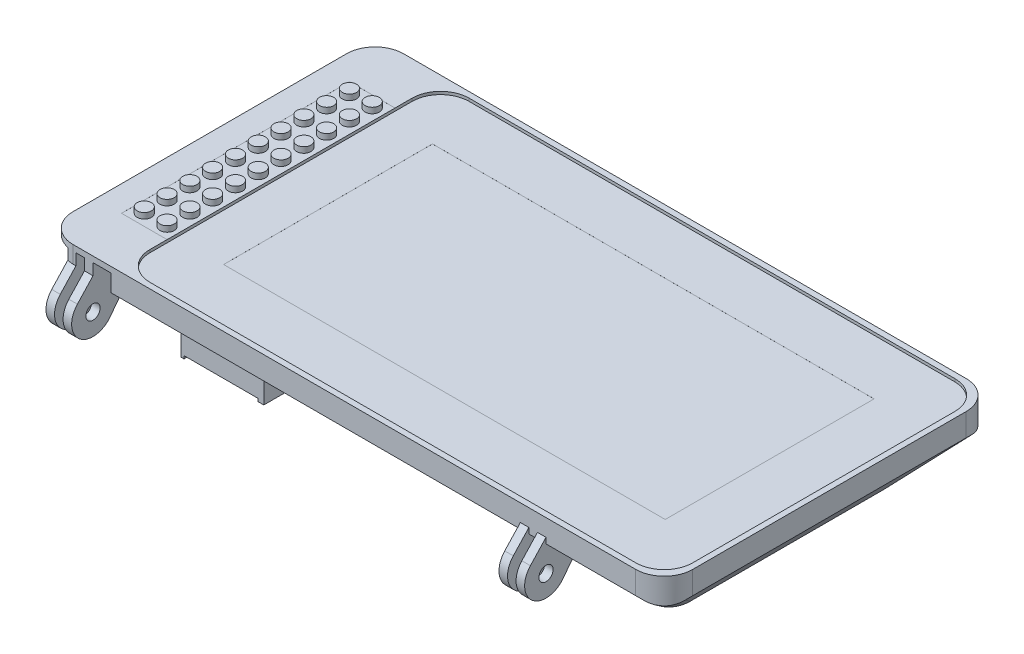
from build123d import *

# Parameters (mm, degrees)
CROQUIS2_W                    = 217.5
CROQUIS2_H                    = 116
SALIENTE_EXTRUIR1_DEPTH       = 12
CORTAR_EXTRUIR1_DEPTH         = 1
CROQUIS4_W                    = 16
CROQUIS4_H                    = 80
CORTAR_EXTRUIR2_DEPTH         = 0.01
CROQUIS5_R                    = 2.5
SALIENTE_EXTRUIR2_DEPTH       = 2
CROQUIS6_W                    = 155
CROQUIS6_H                    = 73.311227048
CORTAR_EXTRUIR3_DEPTH         = 0.01
CORTAR_EXTRUIR5_DEPTH         = 125.041455167
CORTAR_EXTRUIR5_DEPTH_BACK    = 125.041455167
CROQUIS15_W                   = 32.5
CROQUIS15_H                   = 16
CORTAR_EXTRUIR6_DEPTH         = 10.5
SALIENTE_EXTRUIR4_DEPTH       = 2
SALIENTE_EXTRUIR4_DEPTH_BACK  = 2
CROQUIS16_W                   = 32.5
CROQUIS16_H                   = 16
SALIENTE_EXTRUIR10_START      = -2
SALIENTE_EXTRUIR10_DEPTH      = 5
CROQUIS18_R                   = 2.5
CORTAR_EXTRUIR7_DEPTH         = 9
CROQUIS19_R                   = 3.5
CORTAR_EXTRUIR8_DEPTH         = 4
CROQUIS20_R                   = 1.5
CORTAR_EXTRUIR9_DEPTH         = 4
CORTAR_EXTRUIR10_DEPTH        = 13.5
CROQUIS22_W                   = 5
CROQUIS22_H                   = 1.5
SALIENTE_EXTRUIR11_DEPTH      = 11
SALIENTE_EXTRUIR12_START      = 6
SALIENTE_EXTRUIR12_DEPTH      = 6
CROQUIS23_W                   = 24
CROQUIS23_H                   = 8.8
CORTAR_EXTRUIR12_DEPTH        = 1
CROQUIS25_W                   = 29
CROQUIS25_H                   = 8.5
CORTAR_EXTRUIR13_DEPTH        = 11
CROQUIS26_W                   = 27
CROQUIS26_H                   = 2
SALIENTE_EXTRUIR13_DEPTH      = 11
SALIENTE_EXTRUIR14_DEPTH      = 14
CORTAR_EXTRUIR14_DEPTH        = 23
CORTAR_EXTRUIR15_DEPTH        = 6
CORTAR_EXTRUIR15_DEPTH_BACK   = 23
CROQUIS30_W                   = 26
CROQUIS30_H                   = 31.5
CORTAR_EXTRUIR16_DEPTH        = 16
SALIENTE_EXTRUIR15_DEPTH      = 12
SALIENTE_EXTRUIR15_DEPTH_BACK = 6
REDONDEO1_R                   = 4
CORTAR_EXTRUIR17_DEPTH        = 14.5
CROQUIS33_R                   = 2.5
SALIENTE_EXTRUIR16_DEPTH      = 3
MATRIZL1_COUNT                = 2
MATRIZL1_PITCH                = 6
CORTAR_EXTRUIR18_DEPTH        = 21
MATRIZL2_COUNT                = 2
MATRIZL2_PITCH                = 159
MATRIZL2_COPY_1_SKETCH_R      = 2.5
MATRIZL2_COPY_1_DEPTH         = 3
REDONDEO2_R                   = 10
REDONDEO3_R                   = 10


with BuildPart() as part:
    # Croquis2 → Saliente-Extruir1 (new, symmetric)
    with BuildSketch(Plane(origin=(0, 0, 0), x_dir=(1, 0, 0), z_dir=(0, 1, 0))):
        Rectangle(CROQUIS2_W, CROQUIS2_H)
    extrude(amount=SALIENTE_EXTRUIR1_DEPTH, both=True)

    # Croquis3 → Cortar-Extruir1 (cut)
    with BuildSketch(Plane(origin=(0, 12, 0), x_dir=(1, 0, 0), z_dir=(0, 1, 0))):
        with BuildLine():
            Line((-73.75, 56), (96.75, 56))
            ThreePointArc((96.75, 56), (103.821067812, 53.071067812), (106.75, 46))
            Line((106.75, 46), (106.75, -46))
            ThreePointArc((106.75, -46), (103.821067812, -53.071067812), (96.75, -56))
            Line((96.75, -56), (-73.75, -56))
            ThreePointArc((-73.75, -56), (-80.821067812, -53.071067812), (-83.75, -46))
            Line((-83.75, -46), (-83.75, 46))
            ThreePointArc((-83.75, 46), (-80.821067812, 53.071067812), (-73.75, 56))
        make_face()
    extrude(amount=-CORTAR_EXTRUIR1_DEPTH, mode=Mode.SUBTRACT)

    # Croquis4 → Cortar-Extruir2 (cut)
    with BuildSketch(Plane(origin=(0, 12, 0), x_dir=(1, 0, 0), z_dir=(0, 1, 0))):
        with Locations((-91.75, 0)):
            Rectangle(CROQUIS4_W, CROQUIS4_H)
    extrude(amount=-CORTAR_EXTRUIR2_DEPTH, mode=Mode.SUBTRACT)

    # Croquis5 → Saliente-Extruir2 (add)
    with BuildSketch(Plane(origin=(0, 11.99, 0), x_dir=(1, 0, 0), z_dir=(0, 1, 0))):
        with Locations(Location((-95.75, 36, 0), (0, 0, 270))):
            Circle(CROQUIS5_R)
        with Locations(Location((-87.75, 36, 0), (0, 0, 270))):
            Circle(CROQUIS5_R)
        with Locations(Location((-87.75, 28, 0), (0, 0, 270))):
            Circle(CROQUIS5_R)
        with Locations(Location((-95.75, 28, 0), (0, 0, 270))):
            Circle(CROQUIS5_R)
        with Locations(Location((-87.75, 20, 0), (0, 0, 270))):
            Circle(CROQUIS5_R)
        with Locations(Location((-95.75, 20, 0), (0, 0, 270))):
            Circle(CROQUIS5_R)
        with Locations(Location((-87.75, 12, 0), (0, 0, 270))):
            Circle(CROQUIS5_R)
        with Locations(Location((-95.75, 12, 0), (0, 0, 270))):
            Circle(CROQUIS5_R)
        with Locations(Location((-87.75, 4, 0), (0, 0, 270))):
            Circle(CROQUIS5_R)
        with Locations(Location((-95.75, 4, 0), (0, 0, 270))):
            Circle(CROQUIS5_R)
        with Locations(Location((-87.75, -4, 0), (0, 0, 270))):
            Circle(CROQUIS5_R)
        with Locations(Location((-95.75, -4, 0), (0, 0, 270))):
            Circle(CROQUIS5_R)
        with Locations(Location((-87.75, -12, 0), (0, 0, 270))):
            Circle(CROQUIS5_R)
        with Locations(Location((-95.75, -12, 0), (0, 0, 270))):
            Circle(CROQUIS5_R)
        with Locations(Location((-87.75, -20, 0), (0, 0, 270))):
            Circle(CROQUIS5_R)
        with Locations(Location((-95.75, -20, 0), (0, 0, 270))):
            Circle(CROQUIS5_R)
        with Locations(Location((-87.75, -28, 0), (0, 0, 270))):
            Circle(CROQUIS5_R)
        with Locations(Location((-95.75, -28, 0), (0, 0, 270))):
            Circle(CROQUIS5_R)
        with Locations(Location((-87.75, -36, 0), (0, 0, 270))):
            Circle(CROQUIS5_R)
        with Locations(Location((-95.75, -36, 0), (0, 0, 270))):
            Circle(CROQUIS5_R)
    extrude(amount=SALIENTE_EXTRUIR2_DEPTH)

    # Croquis6 → Cortar-Extruir3 (cut)
    with BuildSketch(Plane(origin=(0, 11, 0), x_dir=(1, 0, 0), z_dir=(0, 1, 0))):
        with Locations((10.25, 0)):
            Rectangle(CROQUIS6_W, CROQUIS6_H)
    extrude(amount=-CORTAR_EXTRUIR3_DEPTH, mode=Mode.SUBTRACT)

    # Cortar-Barrer2: sweep along a path in Croquis7
    with BuildLine(Plane.XZ.offset(12)) as cortar_barrer2_path:
        Line((94, 41.5), (-94, 41.5))
        Line((-94, 41.5), (-94, -41.5))
        Line((-94, -41.5), (94, -41.5))
        Line((94, -41.5), (94, 41.5))
    # Croquis13 → Cortar-Barrer2 (sweep, cut)
    with BuildSketch(Plane(origin=(-31.627280847, 0, 28.272872273), x_dir=(0.6664646029534657, 0, 0.7455366744903161), z_dir=(-0.7455366744903161, 0, 0.6664646029534657))):
        Polygon((-93.587444669, -12), (-115.719152692, 4), (-115.719152692, -12), align=None)
    sweep(path=cortar_barrer2_path.line, transition=Transition.RIGHT, mode=Mode.SUBTRACT)

    # Croquis14 → Cortar-Extruir5 (cut, two sides: drawn at the far end of the back side and taken through both)
    with BuildSketch(Plane.XY.offset(-CORTAR_EXTRUIR5_DEPTH_BACK)):
        Polygon((-94, -12), (-108.75, -12), (-108.75, 4), align=None)
        Polygon((94, -12), (108.75, 4), (108.75, -12), align=None)
    extrude(amount=CORTAR_EXTRUIR5_DEPTH + CORTAR_EXTRUIR5_DEPTH_BACK, mode=Mode.SUBTRACT)

    # Croquis15 → Cortar-Extruir6 (cut)
    with BuildSketch(Plane.XZ.offset(12)):
        with Locations((-32.75, -45.5)):
            Rectangle(CROQUIS15_W, CROQUIS15_H)
    extrude(amount=-CORTAR_EXTRUIR6_DEPTH, mode=Mode.SUBTRACT)

    # Croquis16 → Saliente-Extruir4 (add, two sides: drawn at the far end of the back side and taken through both)
    with BuildSketch(Plane.XZ.offset(1.5).offset(-SALIENTE_EXTRUIR4_DEPTH_BACK)):
        with Locations((-32.75, -45.5)):
            Rectangle(CROQUIS16_W, CROQUIS16_H)
    extrude(amount=SALIENTE_EXTRUIR4_DEPTH + SALIENTE_EXTRUIR4_DEPTH_BACK)

    # Croquis17 → Saliente-Extruir10 (add)
    with BuildSketch(Plane.XZ.offset(3.5).offset(SALIENTE_EXTRUIR10_START)):
        Polygon((-49, -52), (-50.5, -52), (-50.5, -55.5), (-15, -55.5), (-15, -52), (-16.5, -52), (-16.5, -53.5), (-49, -53.5), align=None)
    extrude(amount=-SALIENTE_EXTRUIR10_DEPTH)

    # Croquis18 → Cortar-Extruir7 (cut)
    with BuildSketch(Plane.XZ.offset(12)):
        with Locations(Location((-11.5, -37.5, 0), (0, 0, 270))):
            Circle(CROQUIS18_R)
        with Locations(Location((63.5, -37.5, 0), (0, 0, 270))):
            Circle(CROQUIS18_R)
        with Locations(Location((63.5, 37.5, 0), (0, 0, 90))):
            Circle(CROQUIS18_R)
        with Locations(Location((-11.5, 37.5, 0), (0, 0, 90))):
            Circle(CROQUIS18_R)
    extrude(amount=-CORTAR_EXTRUIR7_DEPTH, mode=Mode.SUBTRACT)

    # Croquis19 → Cortar-Extruir8 (cut)
    with BuildSketch(Plane.XZ.offset(12)):
        with Locations(Location((73.5, -35, 0), (0, 0, 270))):
            Circle(CROQUIS19_R)
        with Locations(Location((73.5, 35, 0), (0, 0, 90))):
            Circle(CROQUIS19_R)
    extrude(amount=-CORTAR_EXTRUIR8_DEPTH, mode=Mode.SUBTRACT)

    # Croquis20 → Cortar-Extruir9 (cut)
    with BuildSketch(Plane.XZ.offset(8)):
        with Locations(Location((73.5, 35, 0), (0, 0, 270))):
            Circle(CROQUIS20_R)
        with Locations(Location((73.5, -35, 0), (0, 0, 270))):
            Circle(CROQUIS20_R)
    extrude(amount=-CORTAR_EXTRUIR9_DEPTH, mode=Mode.SUBTRACT)

    # Croquis21 → Cortar-Extruir10 (cut)
    with BuildSketch(Plane.XZ.offset(12)):
        with BuildLine():
            Line((-22.5, -34), (-22.5, -12.7))
            Line((-22.5, -12.7), (-10.5, -12.7))
            Line((-10.5, -12.7), (-10.5, 13.3))
            Line((-10.5, 13.3), (-22.5, 13.3))
            Line((-22.5, 13.3), (-22.5, 30.3))
            Line((-22.5, 30.3), (-18.5, 30.3))
            Line((-18.5, 30.3), (-18.5, 41.5))
            Line((-18.5, 41.5), (-18.5, 56.8))
            Line((-18.5, 56.8), (-40.5, 56.8))
            Line((-40.5, 56.8), (-40.5, 30.3))
            Line((-40.5, 30.3), (-37.5, 30.3))
            Line((-37.5, 30.3), (-37.5, 28.8))
            Line((-37.5, 28.8), (-45.5, 28.8))
            Line((-45.5, 28.8), (-45.5, 34.8))
            ThreePointArc((-45.5, 34.8), (-49, 38.3), (-52.5, 34.8))
            Line((-52.5, 34.8), (-52.5, 29.8))
            Line((-52.5, 29.8), (-62.5, 29.8))
            Line((-62.5, 29.8), (-62.5, 28.8))
            Line((-62.5, 28.8), (-71.5, 28.8))
            Line((-71.5, 28.8), (-71.5, 30.3))
            Line((-71.5, 30.3), (-68.5, 30.3))
            Line((-68.5, 30.3), (-68.5, 56.8))
            Line((-68.5, 56.8), (-85.5, 56.8))
            Line((-85.5, 56.8), (-85.5, 44.8))
            Line((-85.5, 44.8), (-83.5, 44.8))
            Line((-83.5, 44.8), (-83.5, 30.3))
            Line((-83.5, 30.3), (-79.5, 30.3))
            Line((-79.5, 30.3), (-79.5, 28.8))
            Line((-79.5, 28.8), (-108.75, 28.8))
            Line((-108.75, 28.8), (-108.75, -31.5))
            Line((-108.75, -31.5), (-94, -31.5))
            Line((-94, -31.5), (-93, -31.5))
            Line((-93, -31.5), (-93, -34))
            Line((-93, -34), (-86, -34))
            Line((-86, -34), (-86, -31.5))
            Line((-86, -31.5), (-56.5, -31.5))
            Line((-56.5, -31.5), (-56.5, -35.5))
            ThreePointArc((-56.5, -35.5), (-53, -39), (-49.5, -35.5))
            Line((-49.5, -35.5), (-49.5, -31.5))
            Line((-49.5, -31.5), (-30.5, -31.5))
            Line((-30.5, -31.5), (-30.5, -34))
            Line((-30.5, -34), (-22.5, -34))
        make_face()
    extrude(amount=-CORTAR_EXTRUIR10_DEPTH, mode=Mode.SUBTRACT)

    # Croquis22 → Saliente-Extruir11 (add)
    with BuildSketch(Plane.XZ.offset(-1.5)):
        with Locations((-25, 29.55)):
            Rectangle(CROQUIS22_W, CROQUIS22_H)
    extrude(amount=SALIENTE_EXTRUIR11_DEPTH)

    # Croquis24 → Saliente-Extruir12 (add)
    with BuildSketch(Plane.XZ.offset(-1.5).offset(SALIENTE_EXTRUIR12_START)):
        with BuildLine():
            Line((-52.5, 29.8), (-45.5, 29.8))
            Line((-45.5, 29.8), (-45.5, 34.8))
            ThreePointArc((-45.5, 34.8), (-49, 38.3), (-52.5, 34.8))
            Line((-52.5, 34.8), (-52.5, 29.8))
        make_face()
    extrude(amount=-SALIENTE_EXTRUIR12_DEPTH)

    # Croquis23 → Cortar-Extruir12 (cut)
    with BuildSketch(Plane.XZ.offset(12)):
        with Locations((-54.5, 45.9)):
            Rectangle(CROQUIS23_W, CROQUIS23_H)
        with BuildLine():
            Line((-42.5, 31.305882353), (-42.5, 41.5))
            Line((-42.5, 41.5), (-66.5, 41.5))
            Line((-66.5, 41.5), (-66.5, 31.3))
            ThreePointArc((-66.5, 31.3), (-66.792893219, 30.592893219), (-67.5, 30.3))
            Line((-67.5, 30.3), (-68.5, 30.3))
            Line((-68.5, 30.3), (-71.5, 30.3))
            Line((-71.5, 30.3), (-71.5, 28.8))
            Line((-71.5, 28.8), (-62.5, 28.8))
            Line((-62.5, 28.8), (-62.5, 29.8))
            Line((-62.5, 29.8), (-52.5, 29.8))
            Line((-52.5, 29.8), (-52.5, 34.8))
            ThreePointArc((-52.5, 34.8), (-49, 38.3), (-45.5, 34.8))
            Line((-45.5, 34.8), (-45.5, 28.8))
            Line((-45.5, 28.8), (-37.5, 28.8))
            Line((-37.5, 28.8), (-37.5, 30.3))
            Line((-37.5, 30.3), (-40.5, 30.3))
            Line((-40.5, 30.3), (-41.505865052, 30.305899553))
            ThreePointArc((-41.505865052, 30.305899553), (-42.209177359, 30.600852231), (-42.5, 31.305882353))
        make_face()
    extrude(amount=-CORTAR_EXTRUIR12_DEPTH, mode=Mode.SUBTRACT)

    # Croquis25 → Cortar-Extruir13 (cut)
    with BuildSketch(Plane.XZ.offset(11)):
        with Locations((-57, 43.05)):
            Rectangle(CROQUIS25_W, CROQUIS25_H)
    extrude(amount=-CORTAR_EXTRUIR13_DEPTH, mode=Mode.SUBTRACT)

    # Croquis26 → Saliente-Extruir13 (add)
    with BuildSketch(Plane.XZ):
        with Locations((-56, 48.3)):
            Rectangle(CROQUIS26_W, CROQUIS26_H)
    extrude(amount=SALIENTE_EXTRUIR13_DEPTH)

    # Croquis27 → Saliente-Extruir14 (add)
    with BuildSketch(Plane.XZ.offset(12)):
        with BuildLine():
            Line((-69.5, 49.3), (-68.5, 49.3))
            Line((-68.5, 49.3), (-68.5, 30.3))
            Line((-68.5, 30.3), (-70.5, 30.3))
            ThreePointArc((-70.5, 30.3), (-69.792893219, 30.592893219), (-69.5, 31.3))
            Line((-69.5, 31.3), (-69.5, 49.3))
        make_face()
        with BuildLine():
            Line((-42.5, 49.3), (-40.5, 49.3))
            Line((-40.5, 49.3), (-40.5, 30.3))
            Line((-40.5, 30.3), (-41.5, 30.3))
            ThreePointArc((-41.5, 30.3), (-42.207106781, 30.592893219), (-42.5, 31.3))
            Line((-42.5, 31.3), (-42.5, 49.3))
        make_face()
    extrude(amount=-SALIENTE_EXTRUIR14_DEPTH)

    # Croquis28 → Cortar-Extruir14 (cut)
    with BuildSketch(Plane(origin=(0, 4, 0), x_dir=(1, 0, 0), z_dir=(0, 1, 0))):
        Polygon((-108.75, 58), (-85.75, 58), (-85.75, 43), (-102.75, 43), (-102.75, 33), (-108.75, 33), align=None)
    extrude(amount=-CORTAR_EXTRUIR14_DEPTH, mode=Mode.SUBTRACT)

    # Croquis29 → Cortar-Extruir15 (cut, two sides: drawn at the far end of the back side and taken through both)
    with BuildSketch(Plane(origin=(0, 4, 0), x_dir=(1, 0, 0), z_dir=(0, 1, 0)).offset(-CORTAR_EXTRUIR15_DEPTH_BACK)):
        Polygon((-108.75, -29.5), (-102.75, -29.5), (-102.75, -44.8), (-85.5, -44.8), (-85.5, -58), (-108.75, -58), align=None)
    extrude(amount=CORTAR_EXTRUIR15_DEPTH + CORTAR_EXTRUIR15_DEPTH_BACK, mode=Mode.SUBTRACT)

    # Croquis30 → Cortar-Extruir16 (cut)
    with BuildSketch(Plane.XZ.offset(12)):
        with Locations((35.5, 42.25)):
            Rectangle(CROQUIS30_W, CROQUIS30_H)
    extrude(amount=-CORTAR_EXTRUIR16_DEPTH, mode=Mode.SUBTRACT)

    # Croquis31 → Saliente-Extruir15 (add, two sides: drawn at the far end of the back side and taken through both)
    with BuildSketch(Plane.XZ.offset(-4).offset(-SALIENTE_EXTRUIR15_DEPTH_BACK)):
        Polygon((-94, -31.5), (-107.75, -31.5), (-107.75, 28.8), (-94, 28.8), (-94, 30.3), (-108.75, 30.3), (-108.75, -33), (-94, -33), align=None)
    extrude(amount=SALIENTE_EXTRUIR15_DEPTH + SALIENTE_EXTRUIR15_DEPTH_BACK)

    # Redondeo1
    redondeo1_edges = [part.edges().sort_by_distance(p)[0] for p in [
        (-108.75, 1, 30.3),
        (-108.75, -2, -33),
        (-107.75, -2.542372881, -31.5),
        (-107.75, -2.542372881, 28.8),
    ]]
    fillet(redondeo1_edges, radius=REDONDEO1_R)

    # Croquis32 → Cortar-Extruir17 (cut)
    with BuildSketch(Plane.XY.offset(44.8)):
        Polygon((-102.75, 5), (-96.95, -8.8), (-102.75, -2.508474576), align=None)
    extrude(amount=-CORTAR_EXTRUIR17_DEPTH, mode=Mode.SUBTRACT)

    # Croquis33 → Saliente-Extruir16 (add)
    with BuildSketch(Plane.ZY.offset(100.75)):
        with BuildLine():
            Line((58, 10), (58, 6))
            Line((58, 6), (63.486412593, 0.113636364))
            ThreePointArc((63.486412593, 0.113636364), (62.828109421, -10.739282134), (52.022690735, -9.530096461))
            Line((52.022690735, -9.530096461), (44.8, 0))
            Line((44.8, 0), (44.8, 10))
            Line((44.8, 10), (58, 10))
        make_face()
        with Locations((58, -5)):
            Circle(CROQUIS33_R, mode=Mode.SUBTRACT)
    saliente_extruir16 = extrude(amount=-SALIENTE_EXTRUIR16_DEPTH)

    # MatrizL1: Saliente-Extruir16 ×2
    with Locations(*[(i * MATRIZL1_PITCH, 0, 0) for i in range(1, MATRIZL1_COUNT)]):
        add(saliente_extruir16)

    # Croquis34 → Cortar-Extruir18 (cut)
    with BuildSketch(Plane.ZY.offset(-48.5)):
        with BuildLine():
            Line((58, 4), (41.5, -12))
            Line((41.5, -12), (40.063519383, -12))
            Line((40.063519383, -12), (55.981688945, 3.435800787))
            ThreePointArc((55.981688945, 3.435800787), (56.622848662, 3.853591321), (57.373980617, 4))
            Line((57.373980617, 4), (58, 4))
        make_face()
    extrude(amount=-CORTAR_EXTRUIR18_DEPTH, mode=Mode.SUBTRACT)

    # MatrizL2: Saliente-Extruir16 ×2
    with Locations(*[(i * MATRIZL2_PITCH, 0, 0) for i in range(1, MATRIZL2_COUNT)]):
        add(saliente_extruir16)

    # MatrizL2 copy 1 sketch → MatrizL2 copy 1 (add)
    with BuildSketch(Plane.ZY.offset(-64.25)):
        with BuildLine():
            Line((58, 10), (58, 6))
            Line((58, 6), (63.486412593, 0.113636364))
            ThreePointArc((63.486412593, 0.113636364), (62.828109421, -10.739282134), (52.022690735, -9.530096461))
            Line((52.022690735, -9.530096461), (44.8, 0))
            Line((44.8, 0), (44.8, 10))
            Line((44.8, 10), (58, 10))
        make_face()
        with Locations((58, -5)):
            Circle(MATRIZL2_COPY_1_SKETCH_R, mode=Mode.SUBTRACT)
    extrude(amount=-MATRIZL2_COPY_1_DEPTH)

    # Redondeo2
    redondeo2_edges = [part.edges().sort_by_distance(p)[0] for p in [
        (108.75, 8, 58),
        (108.75, 8, -58),
        (-108.75, 11, 58),
        (-108.75, 8, -58),
    ]]
    fillet(redondeo2_edges, radius=REDONDEO2_R)

    # Redondeo3
    redondeo3_edges = [part.edges().sort_by_distance(p)[0] for p in [
        (-95.475, -10.4, 43.15),
        (-99.045454545, -6.526964561, -43),
        (99.991644831, -5.500588658, 48.202517946),
        (99.991644831, -5.500588658, -48.202517946),
    ]]
    fillet(redondeo3_edges, radius=REDONDEO3_R)


solid = part.part
